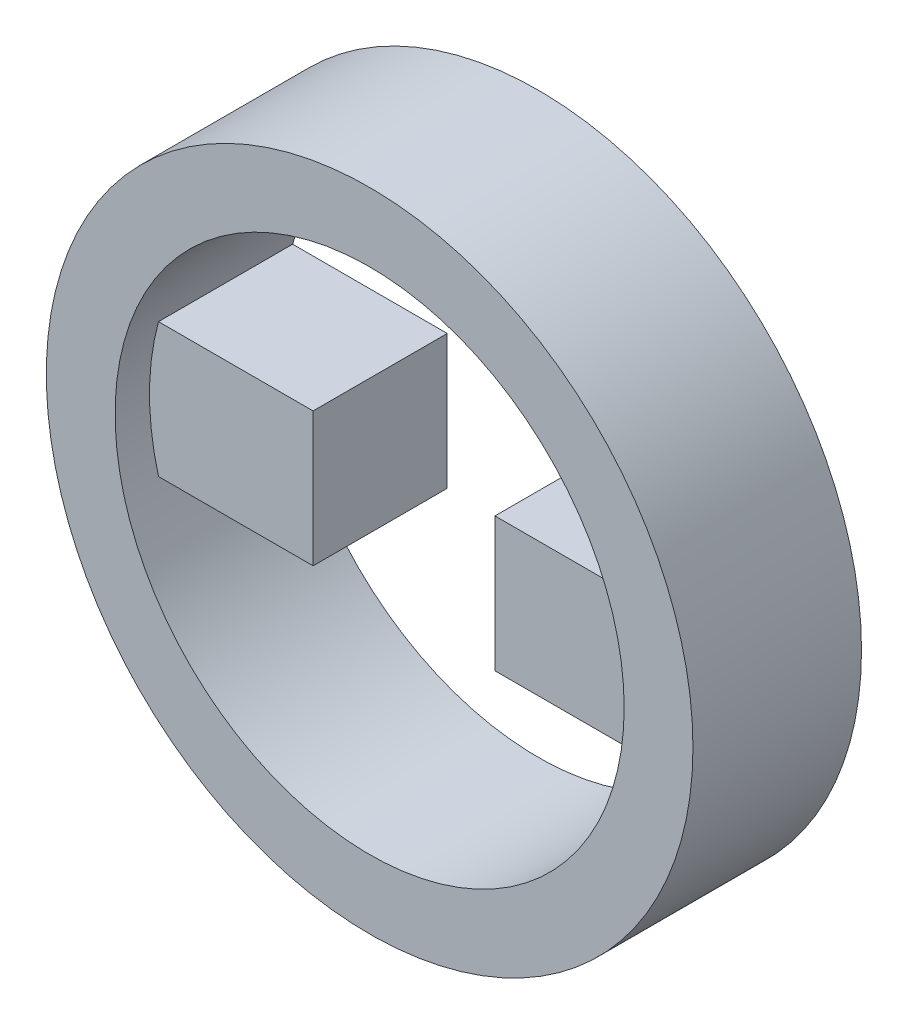
from build123d import *

# Parameters (mm, degrees)
SKETCH_1_R        = 9.4
SKETCH_1_R_2      = 7.4
EXTRUDE_1_DEPTH   = 4.9
SKETCH_2_W        = 5.498524857
SKETCH_2_H        = 3.9
EXTRUDE_1_2_DEPTH = 3.9


with BuildPart() as part:
    # 草图1 → Extrude 1 (new body)
    with BuildSketch(Plane.XY):
        Circle(SKETCH_1_R)
        Circle(SKETCH_1_R_2, mode=Mode.SUBTRACT)
    extrude(amount=EXTRUDE_1_DEPTH)

    # 草图2 → Extrude 1 2 (add)
    with BuildSketch(Plane.XY):
        with Locations((5.39294726, 0)):
            Rectangle(SKETCH_2_W, SKETCH_2_H)
        with Locations((-5.39294726, 0)):
            Rectangle(SKETCH_2_W, SKETCH_2_H)
    extrude(amount=EXTRUDE_1_2_DEPTH)


solid = part.part
